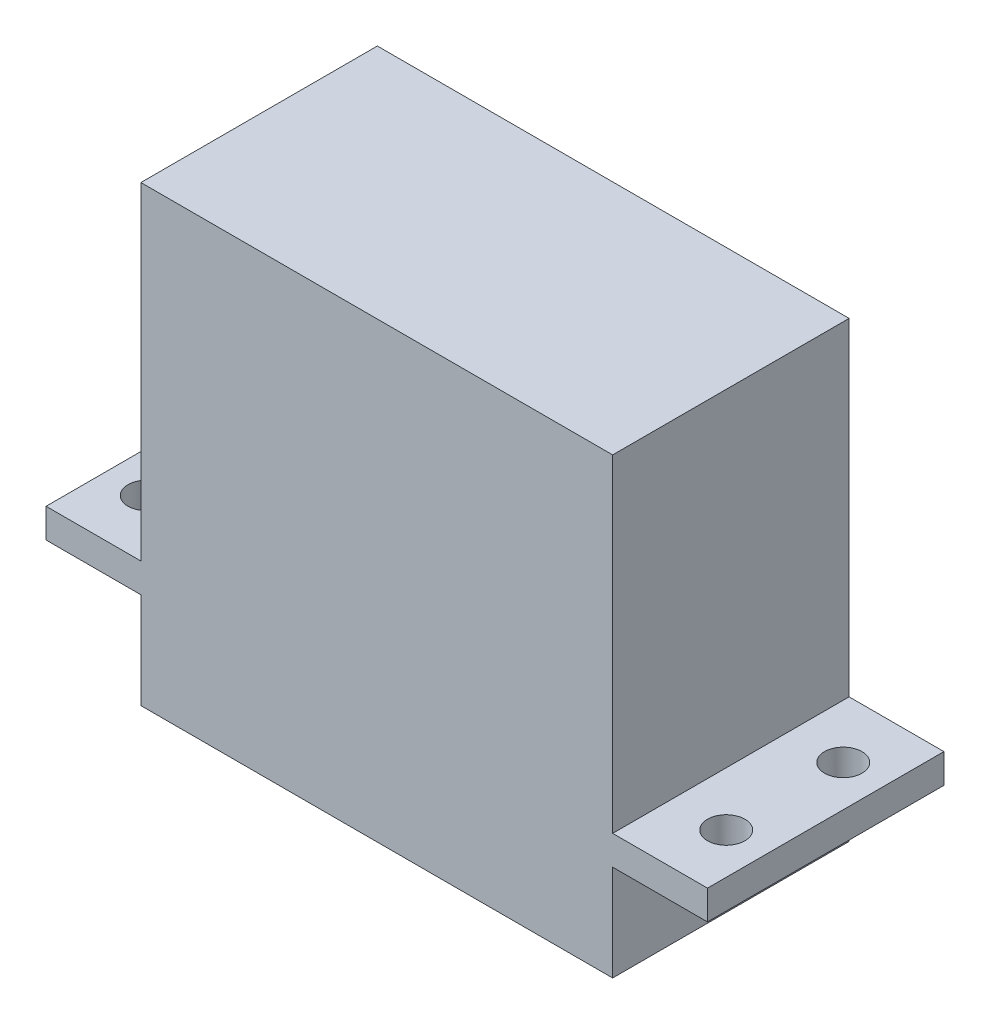
from build123d import *

# Parameters (mm, degrees)
CASE_SKETCH_W      = 40.3
CASE_SKETCH_H      = 38.7
CASE_2_DEPTH       = 10.1
TABS_SKETCH_W      = 8.1
TABS_SKETCH_H      = 2.5
TABS_DEPTH         = 10.1
SHAFT_SKETCH_W     = 3
SHAFT_SKETCH_H     = 4
TAB_HOLES_SKETCH_R = 1.6
TAB_HOLES_DEPTH    = 52.7


with BuildPart() as part:
    # Case Sketch → Case 2 (new, symmetric)
    with BuildSketch(Plane.XY):
        with Locations((10.1, 23.35)):
            Rectangle(CASE_SKETCH_W, CASE_SKETCH_H)
    extrude(amount=CASE_2_DEPTH, both=True)

    # Tabs Sketch → Tabs (add, symmetric)
    with BuildSketch(Plane.XY):
        with Locations((-14.1, 13.45)):
            Rectangle(TABS_SKETCH_W, TABS_SKETCH_H)
        with Locations((34.3, 13.45)):
            Rectangle(TABS_SKETCH_W, TABS_SKETCH_H)
    extrude(amount=TABS_DEPTH, both=True)

    # Shaft Sketch → Shaft (revolve)
    with BuildSketch(Plane.XY):
        with Locations((1.5, 2)):
            Rectangle(SHAFT_SKETCH_W, SHAFT_SKETCH_H)
    revolve(axis=Axis((0, -500, 0), (0, 1, 0)))

    # Tab Holes Sketch → Tab Holes (cut, symmetric)
    with BuildSketch(Plane(origin=(0, 0, 0), x_dir=(1, 0, 0), z_dir=(0, 1, 0))):
        with Locations((-14.65, -5)):
            Circle(TAB_HOLES_SKETCH_R)
        with Locations((-14.65, 5)):
            Circle(TAB_HOLES_SKETCH_R)
        with Locations((34.85, -5)):
            Circle(TAB_HOLES_SKETCH_R)
        with Locations((34.85, 5)):
            Circle(TAB_HOLES_SKETCH_R)
    extrude(amount=TAB_HOLES_DEPTH, both=True, mode=Mode.SUBTRACT)


solid = part.part
